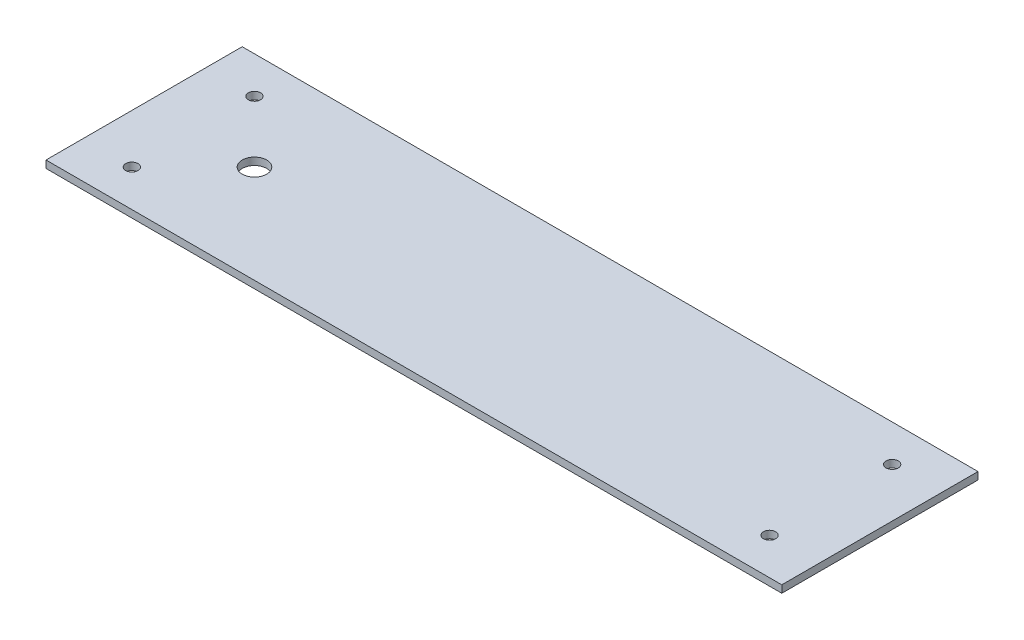
from build123d import *

# Parameters (mm, degrees)
SKETCH1_W           = 300
SKETCH1_H           = 80
SKETCH1_R           = 2.5
SKETCH1_R_2         = 5
BOSS_EXTRUDE1_DEPTH = 3


with BuildPart() as part:
    # Sketch1 → Boss-Extrude1 (new body)
    with BuildSketch(Plane(origin=(0, 0, 0), x_dir=(1, 0, 0), z_dir=(0, 1, 0))):
        with Locations((-0.279396377, -0.312194143)):
            Rectangle(SKETCH1_W, SKETCH1_H)
        with Locations(Location((-130.279396377, 24.687805857, 0), (0, 0, 270))):
            Circle(SKETCH1_R, mode=Mode.SUBTRACT)
        with Locations(Location((-130.279396377, -25.312194143, 0), (0, 0, 270))):
            Circle(SKETCH1_R, mode=Mode.SUBTRACT)
        with Locations(Location((129.720603623, 24.687805857, 0), (0, 0, 270))):
            Circle(SKETCH1_R, mode=Mode.SUBTRACT)
        with Locations(Location((129.720603623, -25.312194143, 0), (0, 0, 270))):
            Circle(SKETCH1_R, mode=Mode.SUBTRACT)
        with Locations(Location((-105.279396377, -0.312194143, 0), (0, 0, 270))):
            Circle(SKETCH1_R_2, mode=Mode.SUBTRACT)
    extrude(amount=BOSS_EXTRUDE1_DEPTH)


solid = part.part
